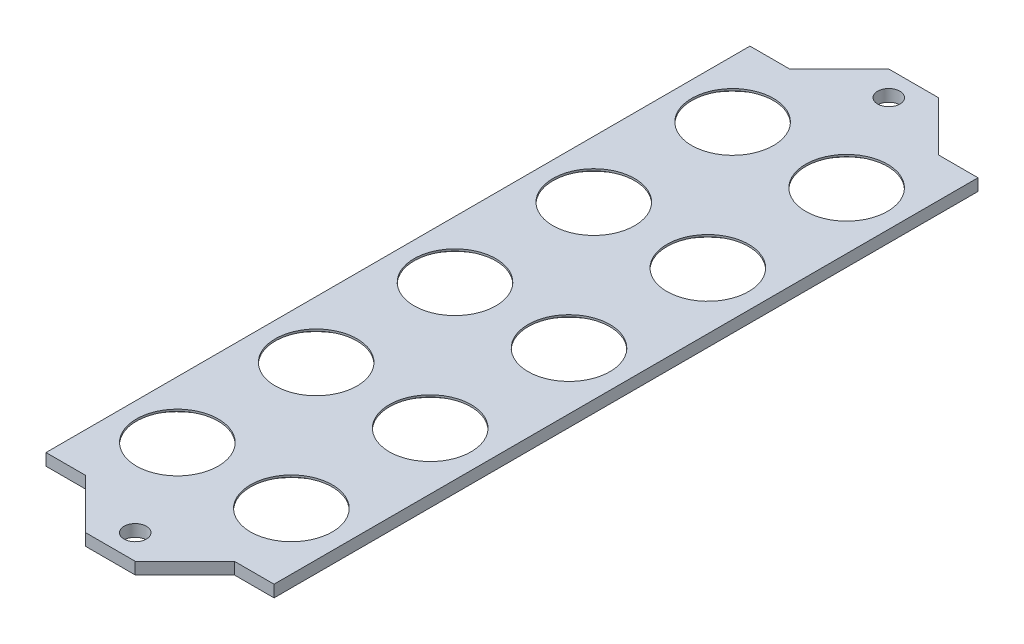
from build123d import *

# Parameters (mm, degrees)
SZKIC1_R                    = 11
SZKIC1_R_2                  = 10.6
SZKIC1_R_3                  = 10.1
SZKIC1_R_4                  = 8.25
SZKIC1_W                    = 10
SZKIC1_H                    = 10
DODANIE_WYCI_GNI_CIE1_DEPTH = 0.4
SZKIC1_3_R                  = 11
DODANIE_WYCI_GNI_CIE2_DEPTH = 2
SZKIC2_R                    = 2.25
WYTNIJ_WYCI_GNI_CIE1_DEPTH  = 20


with BuildPart() as part:
    # Szkic1 → Dodanie-wyciągnięcie1 (new body)
    # profile 1 of 43: a face of its own
    with BuildSketch(Plane(origin=(0, 0, 0), x_dir=(1, 0, 0), z_dir=(0, 1, 0))):
        Polygon((6.5, 15), (-3.5, 15), (-11.5, 15), (-11.5, -127), (-3.5, -127), (6.5, -127), (16.5, -127), (26.5, -127), (34.5, -127), (34.5, 15), (26.5, 15), (16.5, 15), align=None)
        with Locations((0, -112)):
            Circle(SZKIC1_R, mode=Mode.SUBTRACT)
        with Locations((0, -84)):
            Circle(SZKIC1_R, mode=Mode.SUBTRACT)
        with Locations((0, -56)):
            Circle(SZKIC1_R, mode=Mode.SUBTRACT)
        with Locations((23, -112)):
            Circle(SZKIC1_R, mode=Mode.SUBTRACT)
        with Locations((23, -84)):
            Circle(SZKIC1_R, mode=Mode.SUBTRACT)
        with Locations((23, -56)):
            Circle(SZKIC1_R, mode=Mode.SUBTRACT)
        with Locations((0, -28)):
            Circle(SZKIC1_R, mode=Mode.SUBTRACT)
        Circle(SZKIC1_R, mode=Mode.SUBTRACT)
        with Locations((23, -28)):
            Circle(SZKIC1_R, mode=Mode.SUBTRACT)
        with Locations((23, 0)):
            Circle(SZKIC1_R, mode=Mode.SUBTRACT)
    # profile 2 of 43: a face of its own
    with BuildSketch(Plane(origin=(0, 0, 0), x_dir=(1, 0, 0), z_dir=(0, 1, 0))):
        Polygon((6.5, 15), (-3.5, 15), (-11.5, 15), (-11.5, -127), (-3.5, -127), (6.5, -127), (16.5, -127), (26.5, -127), (34.5, -127), (34.5, 15), (26.5, 15), (16.5, 15), align=None)
        with Locations((0, -112)):
            Circle(SZKIC1_R, mode=Mode.SUBTRACT)
        with Locations((0, -84)):
            Circle(SZKIC1_R, mode=Mode.SUBTRACT)
        with Locations((0, -56)):
            Circle(SZKIC1_R, mode=Mode.SUBTRACT)
        with Locations((23, -112)):
            Circle(SZKIC1_R, mode=Mode.SUBTRACT)
        with Locations((23, -84)):
            Circle(SZKIC1_R, mode=Mode.SUBTRACT)
        with Locations((23, -56)):
            Circle(SZKIC1_R, mode=Mode.SUBTRACT)
        with Locations((0, -28)):
            Circle(SZKIC1_R, mode=Mode.SUBTRACT)
        Circle(SZKIC1_R, mode=Mode.SUBTRACT)
        with Locations((23, -28)):
            Circle(SZKIC1_R, mode=Mode.SUBTRACT)
        with Locations((23, 0)):
            Circle(SZKIC1_R, mode=Mode.SUBTRACT)
    # profile 3 of 43: a face of its own
    with BuildSketch(Plane(origin=(0, 0, 0), x_dir=(1, 0, 0), z_dir=(0, 1, 0))):
        Polygon((6.5, 15), (-3.5, 15), (-11.5, 15), (-11.5, -127), (-3.5, -127), (6.5, -127), (16.5, -127), (26.5, -127), (34.5, -127), (34.5, 15), (26.5, 15), (16.5, 15), align=None)
        with Locations((0, -112)):
            Circle(SZKIC1_R, mode=Mode.SUBTRACT)
        with Locations((0, -84)):
            Circle(SZKIC1_R, mode=Mode.SUBTRACT)
        with Locations((0, -56)):
            Circle(SZKIC1_R, mode=Mode.SUBTRACT)
        with Locations((23, -112)):
            Circle(SZKIC1_R, mode=Mode.SUBTRACT)
        with Locations((23, -84)):
            Circle(SZKIC1_R, mode=Mode.SUBTRACT)
        with Locations((23, -56)):
            Circle(SZKIC1_R, mode=Mode.SUBTRACT)
        with Locations((0, -28)):
            Circle(SZKIC1_R, mode=Mode.SUBTRACT)
        Circle(SZKIC1_R, mode=Mode.SUBTRACT)
        with Locations((23, -28)):
            Circle(SZKIC1_R, mode=Mode.SUBTRACT)
        with Locations((23, 0)):
            Circle(SZKIC1_R, mode=Mode.SUBTRACT)
    # profile 4 of 43: a face of its own
    with BuildSketch(Plane(origin=(0, 0, 0), x_dir=(1, 0, 0), z_dir=(0, 1, 0))):
        with Locations((0, -28)):
            Circle(SZKIC1_R)
        with Locations((0, -28)):
            Circle(SZKIC1_R_2, mode=Mode.SUBTRACT)
    # profile 5 of 43: a face of its own
    with BuildSketch(Plane(origin=(0, 0, 0), x_dir=(1, 0, 0), z_dir=(0, 1, 0))):
        with Locations((0, -28)):
            Circle(SZKIC1_R)
        with Locations((0, -28)):
            Circle(SZKIC1_R_2, mode=Mode.SUBTRACT)
    # profile 6 of 43: a face of its own
    with BuildSketch(Plane(origin=(0, 0, 0), x_dir=(1, 0, 0), z_dir=(0, 1, 0))):
        with Locations((0, -28)):
            Circle(SZKIC1_R_2)
        with Locations((0, -28)):
            Circle(SZKIC1_R_3, mode=Mode.SUBTRACT)
    # profile 7 of 43: a face of its own
    with BuildSketch(Plane(origin=(0, 0, 0), x_dir=(1, 0, 0), z_dir=(0, 1, 0))):
        with Locations((0, -28)):
            Circle(SZKIC1_R_3)
        with Locations(Location((0, -28, 0), (0, 0, 270))):
            Circle(SZKIC1_R_4, mode=Mode.SUBTRACT)
    # profile 8 of 43: a face of its own
    with BuildSketch(Plane(origin=(0, 0, 0), x_dir=(1, 0, 0), z_dir=(0, 1, 0))):
        with Locations((23, -28)):
            Circle(SZKIC1_R)
        with Locations((23, -28)):
            Circle(SZKIC1_R_2, mode=Mode.SUBTRACT)
    # profile 9 of 43: a face of its own
    with BuildSketch(Plane(origin=(0, 0, 0), x_dir=(1, 0, 0), z_dir=(0, 1, 0))):
        with Locations((23, -28)):
            Circle(SZKIC1_R)
        with Locations((23, -28)):
            Circle(SZKIC1_R_2, mode=Mode.SUBTRACT)
    # profile 10 of 43: a face of its own
    with BuildSketch(Plane(origin=(0, 0, 0), x_dir=(1, 0, 0), z_dir=(0, 1, 0))):
        with Locations((23, -28)):
            Circle(SZKIC1_R_2)
        with Locations((23, -28)):
            Circle(SZKIC1_R_3, mode=Mode.SUBTRACT)
    # profile 11 of 43: a face of its own
    with BuildSketch(Plane(origin=(0, 0, 0), x_dir=(1, 0, 0), z_dir=(0, 1, 0))):
        with Locations((23, -28)):
            Circle(SZKIC1_R_3)
        with Locations(Location((23, -28, 0), (0, 0, 270))):
            Circle(SZKIC1_R_4, mode=Mode.SUBTRACT)
    # profile 12 of 43: a face of its own
    with BuildSketch(Plane(origin=(0, 0, 0), x_dir=(1, 0, 0), z_dir=(0, 1, 0))):
        with Locations((23, 0)):
            Circle(SZKIC1_R)
        with Locations((23, 0)):
            Circle(SZKIC1_R_2, mode=Mode.SUBTRACT)
    # profile 13 of 43: a face of its own
    with BuildSketch(Plane(origin=(0, 0, 0), x_dir=(1, 0, 0), z_dir=(0, 1, 0))):
        with Locations((23, 0)):
            Circle(SZKIC1_R)
        with Locations((23, 0)):
            Circle(SZKIC1_R_2, mode=Mode.SUBTRACT)
    # profile 14 of 43: a face of its own
    with BuildSketch(Plane(origin=(0, 0, 0), x_dir=(1, 0, 0), z_dir=(0, 1, 0))):
        with Locations((23, 0)):
            Circle(SZKIC1_R_2)
        with Locations((23, 0)):
            Circle(SZKIC1_R_3, mode=Mode.SUBTRACT)
    # profile 15 of 43: a face of its own
    with BuildSketch(Plane(origin=(0, 0, 0), x_dir=(1, 0, 0), z_dir=(0, 1, 0))):
        with Locations((23, 0)):
            Circle(SZKIC1_R_3)
        with Locations(Location((23, 0, 0), (0, 0, 270))):
            Circle(SZKIC1_R_4, mode=Mode.SUBTRACT)
    # profile 16 of 43: a face of its own
    with BuildSketch(Plane(origin=(0, 0, 0), x_dir=(1, 0, 0), z_dir=(0, 1, 0))):
        Circle(SZKIC1_R)
        Circle(SZKIC1_R_2, mode=Mode.SUBTRACT)
    # profile 17 of 43: a face of its own
    with BuildSketch(Plane(origin=(0, 0, 0), x_dir=(1, 0, 0), z_dir=(0, 1, 0))):
        Circle(SZKIC1_R)
        Circle(SZKIC1_R_2, mode=Mode.SUBTRACT)
    # profile 18 of 43: a face of its own
    with BuildSketch(Plane(origin=(0, 0, 0), x_dir=(1, 0, 0), z_dir=(0, 1, 0))):
        Circle(SZKIC1_R_2)
        Circle(SZKIC1_R_3, mode=Mode.SUBTRACT)
    # profile 19 of 43: a face of its own
    with BuildSketch(Plane(origin=(0, 0, 0), x_dir=(1, 0, 0), z_dir=(0, 1, 0))):
        Circle(SZKIC1_R_3)
        with Locations(Location((0, 0, 0), (0, 0, 270))):
            Circle(SZKIC1_R_4, mode=Mode.SUBTRACT)
    # profile 20 of 43: a face of its own
    with BuildSketch(Plane(origin=(0, 0, 0), x_dir=(1, 0, 0), z_dir=(0, 1, 0))):
        Polygon((6.5, 15), (6.5, 25), (-3.5, 15), align=None)
    # profile 21 of 43: a face of its own
    with BuildSketch(Plane(origin=(0, 0, 0), x_dir=(1, 0, 0), z_dir=(0, 1, 0))):
        with Locations((11.5, 20)):
            Rectangle(SZKIC1_W, SZKIC1_H)
    # profile 22 of 43: a face of its own
    with BuildSketch(Plane(origin=(0, 0, 0), x_dir=(1, 0, 0), z_dir=(0, 1, 0))):
        Polygon((26.5, 15), (16.5, 25), (16.5, 15), align=None)
    # profile 23 of 43: a face of its own
    with BuildSketch(Plane(origin=(0, 0, 0), x_dir=(1, 0, 0), z_dir=(0, 1, 0))):
        with Locations((0, -56)):
            Circle(SZKIC1_R)
        with Locations((0, -56)):
            Circle(SZKIC1_R_2, mode=Mode.SUBTRACT)
    # profile 24 of 43: a face of its own
    with BuildSketch(Plane(origin=(0, 0, 0), x_dir=(1, 0, 0), z_dir=(0, 1, 0))):
        with Locations((0, -56)):
            Circle(SZKIC1_R_2)
        with Locations((0, -56)):
            Circle(SZKIC1_R_3, mode=Mode.SUBTRACT)
    # profile 25 of 43: a face of its own
    with BuildSketch(Plane(origin=(0, 0, 0), x_dir=(1, 0, 0), z_dir=(0, 1, 0))):
        with Locations((0, -56)):
            Circle(SZKIC1_R_3)
        with Locations(Location((0, -56, 0), (0, 0, 270))):
            Circle(SZKIC1_R_4, mode=Mode.SUBTRACT)
    # profile 26 of 43: a face of its own
    with BuildSketch(Plane(origin=(0, 0, 0), x_dir=(1, 0, 0), z_dir=(0, 1, 0))):
        with Locations((23, -56)):
            Circle(SZKIC1_R)
        with Locations((23, -56)):
            Circle(SZKIC1_R_2, mode=Mode.SUBTRACT)
    # profile 27 of 43: a face of its own
    with BuildSketch(Plane(origin=(0, 0, 0), x_dir=(1, 0, 0), z_dir=(0, 1, 0))):
        with Locations((23, -56)):
            Circle(SZKIC1_R_2)
        with Locations((23, -56)):
            Circle(SZKIC1_R_3, mode=Mode.SUBTRACT)
    # profile 28 of 43: a face of its own
    with BuildSketch(Plane(origin=(0, 0, 0), x_dir=(1, 0, 0), z_dir=(0, 1, 0))):
        with Locations((23, -56)):
            Circle(SZKIC1_R_3)
        with Locations(Location((23, -56, 0), (0, 0, 270))):
            Circle(SZKIC1_R_4, mode=Mode.SUBTRACT)
    # profile 29 of 43: a face of its own
    with BuildSketch(Plane(origin=(0, 0, 0), x_dir=(1, 0, 0), z_dir=(0, 1, 0))):
        with Locations((23, -84)):
            Circle(SZKIC1_R)
        with Locations((23, -84)):
            Circle(SZKIC1_R_2, mode=Mode.SUBTRACT)
    # profile 30 of 43: a face of its own
    with BuildSketch(Plane(origin=(0, 0, 0), x_dir=(1, 0, 0), z_dir=(0, 1, 0))):
        with Locations((23, -84)):
            Circle(SZKIC1_R_2)
        with Locations((23, -84)):
            Circle(SZKIC1_R_3, mode=Mode.SUBTRACT)
    # profile 31 of 43: a face of its own
    with BuildSketch(Plane(origin=(0, 0, 0), x_dir=(1, 0, 0), z_dir=(0, 1, 0))):
        with Locations((23, -84)):
            Circle(SZKIC1_R_3)
        with Locations(Location((23, -84, 0), (0, 0, 270))):
            Circle(SZKIC1_R_4, mode=Mode.SUBTRACT)
    # profile 32 of 43: a face of its own
    with BuildSketch(Plane(origin=(0, 0, 0), x_dir=(1, 0, 0), z_dir=(0, 1, 0))):
        with Locations((0, -84)):
            Circle(SZKIC1_R)
        with Locations((0, -84)):
            Circle(SZKIC1_R_2, mode=Mode.SUBTRACT)
    # profile 33 of 43: a face of its own
    with BuildSketch(Plane(origin=(0, 0, 0), x_dir=(1, 0, 0), z_dir=(0, 1, 0))):
        with Locations((0, -84)):
            Circle(SZKIC1_R_2)
        with Locations((0, -84)):
            Circle(SZKIC1_R_3, mode=Mode.SUBTRACT)
    # profile 34 of 43: a face of its own
    with BuildSketch(Plane(origin=(0, 0, 0), x_dir=(1, 0, 0), z_dir=(0, 1, 0))):
        with Locations((0, -84)):
            Circle(SZKIC1_R_3)
        with Locations(Location((0, -84, 0), (0, 0, 270))):
            Circle(SZKIC1_R_4, mode=Mode.SUBTRACT)
    # profile 35 of 43: a face of its own
    with BuildSketch(Plane(origin=(0, 0, 0), x_dir=(1, 0, 0), z_dir=(0, 1, 0))):
        with Locations((23, -112)):
            Circle(SZKIC1_R)
        with Locations((23, -112)):
            Circle(SZKIC1_R_2, mode=Mode.SUBTRACT)
    # profile 36 of 43: a face of its own
    with BuildSketch(Plane(origin=(0, 0, 0), x_dir=(1, 0, 0), z_dir=(0, 1, 0))):
        with Locations((23, -112)):
            Circle(SZKIC1_R_2)
        with Locations((23, -112)):
            Circle(SZKIC1_R_3, mode=Mode.SUBTRACT)
    # profile 37 of 43: a face of its own
    with BuildSketch(Plane(origin=(0, 0, 0), x_dir=(1, 0, 0), z_dir=(0, 1, 0))):
        with Locations((23, -112)):
            Circle(SZKIC1_R_3)
        with Locations(Location((23, -112, 0), (0, 0, 270))):
            Circle(SZKIC1_R_4, mode=Mode.SUBTRACT)
    # profile 38 of 43: a face of its own
    with BuildSketch(Plane(origin=(0, 0, 0), x_dir=(1, 0, 0), z_dir=(0, 1, 0))):
        with Locations((0, -112)):
            Circle(SZKIC1_R)
        with Locations((0, -112)):
            Circle(SZKIC1_R_2, mode=Mode.SUBTRACT)
    # profile 39 of 43: a face of its own
    with BuildSketch(Plane(origin=(0, 0, 0), x_dir=(1, 0, 0), z_dir=(0, 1, 0))):
        with Locations((0, -112)):
            Circle(SZKIC1_R_2)
        with Locations((0, -112)):
            Circle(SZKIC1_R_3, mode=Mode.SUBTRACT)
    # profile 40 of 43: a face of its own
    with BuildSketch(Plane(origin=(0, 0, 0), x_dir=(1, 0, 0), z_dir=(0, 1, 0))):
        with Locations((0, -112)):
            Circle(SZKIC1_R_3)
        with Locations(Location((0, -112, 0), (0, 0, 270))):
            Circle(SZKIC1_R_4, mode=Mode.SUBTRACT)
    # profile 41 of 43: a face of its own
    with BuildSketch(Plane(origin=(0, 0, 0), x_dir=(1, 0, 0), z_dir=(0, 1, 0))):
        with Locations((11.5, -132)):
            Rectangle(SZKIC1_W, SZKIC1_H)
    # profile 42 of 43: a face of its own
    with BuildSketch(Plane(origin=(0, 0, 0), x_dir=(1, 0, 0), z_dir=(0, 1, 0))):
        Polygon((6.5, -127), (-3.5, -127), (6.5, -137), align=None)
    # profile 43 of 43: a face of its own
    with BuildSketch(Plane(origin=(0, 0, 0), x_dir=(1, 0, 0), z_dir=(0, 1, 0))):
        Polygon((16.5, -137), (26.5, -127), (16.5, -127), align=None)
    extrude(amount=DODANIE_WYCI_GNI_CIE1_DEPTH)

    # Szkic1<3> → Dodanie-wyciągnięcie2 (add)
    with BuildSketch(Plane(origin=(0, 0, 0), x_dir=(1, 0, 0), z_dir=(0, 1, 0))):
        Polygon((16.5, 25), (6.5, 25), (-3.5, 15), (-11.5, 15), (-11.5, -127), (-3.5, -127), (6.5, -137), (16.5, -137), (26.5, -127), (34.5, -127), (34.5, 15), (26.5, 15), align=None)
        with Locations(Location((23, 0, 0), (0, 0, 270))):
            Circle(SZKIC1_3_R, mode=Mode.SUBTRACT)
        with Locations(Location((23, -28, 0), (0, 0, 270))):
            Circle(SZKIC1_3_R, mode=Mode.SUBTRACT)
        with Locations(Location((0, -112, 0), (0, 0, 270))):
            Circle(SZKIC1_3_R, mode=Mode.SUBTRACT)
        with Locations(Location((0, -84, 0), (0, 0, 270))):
            Circle(SZKIC1_3_R, mode=Mode.SUBTRACT)
        with Locations(Location((0, -56, 0), (0, 0, 270))):
            Circle(SZKIC1_3_R, mode=Mode.SUBTRACT)
        with Locations(Location((23, -112, 0), (0, 0, 270))):
            Circle(SZKIC1_3_R, mode=Mode.SUBTRACT)
        with Locations(Location((23, -84, 0), (0, 0, 270))):
            Circle(SZKIC1_3_R, mode=Mode.SUBTRACT)
        with Locations(Location((23, -56, 0), (0, 0, 270))):
            Circle(SZKIC1_3_R, mode=Mode.SUBTRACT)
        with Locations(Location((0, -28, 0), (0, 0, 270))):
            Circle(SZKIC1_3_R, mode=Mode.SUBTRACT)
        with Locations(Location((0, 0, 0), (0, 0, 270))):
            Circle(SZKIC1_3_R, mode=Mode.SUBTRACT)
    extrude(amount=-DODANIE_WYCI_GNI_CIE2_DEPTH)

    # Szkic2 → Wytnij-wyciągnięcie1 (cut)
    with BuildSketch(Plane(origin=(0, 0.4, 0), x_dir=(1, 0, 0), z_dir=(0, 1, 0))):
        with BuildLine():
            ThreePointArc((11.5, 22.25), (9.25, 20), (11.5, 17.75))
            Line((11.5, 17.75), (11.5, 22.25))
        make_face()
        with BuildLine():
            Line((11.5, 22.25), (11.5, 17.75))
            ThreePointArc((11.5, 17.75), (13.090990258, 18.409009742), (13.75, 20))
            ThreePointArc((13.75, 20), (13.090990258, 21.590990258), (11.5, 22.25))
        make_face()
        with Locations(Location((11.5, -132, 0), (0, 0, 270))):
            Circle(SZKIC2_R)
    extrude(amount=-WYTNIJ_WYCI_GNI_CIE1_DEPTH, mode=Mode.SUBTRACT)


solid = part.part
